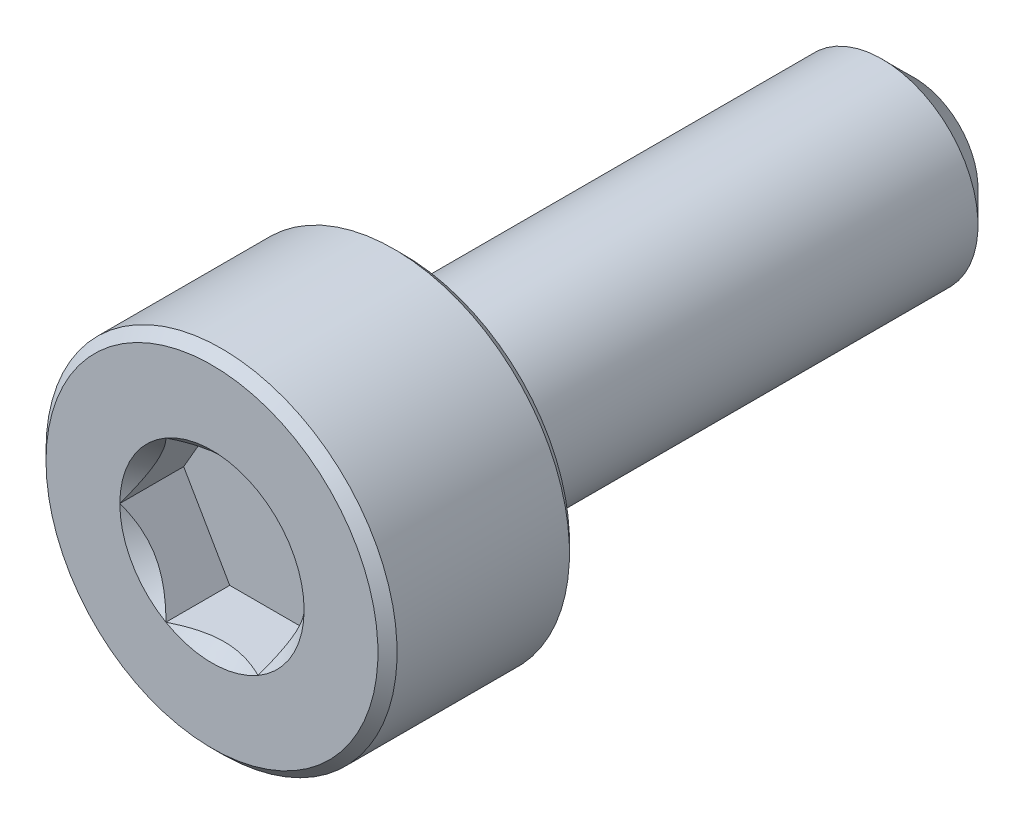
from build123d import *

# Parameters (mm, degrees)
CUT_EXTRUDE1_DEPTH = 1
SKETCH4_R          = 1.443375673
CUT_EXTRUDE2_DEPTH = 0.5
CUT_EXTRUDE2_DRAFT = -45


with BuildPart() as part:
    # Sketch2 → Revolve1 (revolve)
    with BuildSketch(Plane(origin=(0, 0, 0), x_dir=(0, 0, -1), z_dir=(1, 0, 0)), mode=Mode.PRIVATE) as revolve1_sk:
        Polygon((-5.35, 2.75), (-2.65, 2.75), (-2.5, 2.6), (-2.5, 1.5), (5, 1.5), (5.5, 1), (5.5, 0), (-5.5, 0), (-5.5, 2.6), align=None)
    revolve(revolve1_sk.sketch.rotate(Axis((0, 0, -5.5), (0, 0, 1)), 90), axis=Axis((0, 0, -5.5), (0, 0, 1)))

    # Sketch3 → Cut-Extrude1 (cut)
    with BuildSketch(Plane.XY.offset(5.5)):
        Polygon((0.721687836, 1.25), (-0.721687836, 1.25), (-1.443375673, 0), (-0.721687836, -1.25), (0.721687836, -1.25), (1.443375673, 0), align=None)
    extrude(amount=-CUT_EXTRUDE1_DEPTH, mode=Mode.SUBTRACT)


with BuildPart() as cut_extrude2_tool:
    # Sketch4 → Cut-Extrude2 (with draft: the straight prism first)
    with BuildSketch(Plane.XY.offset(5.5)):
        Circle(SKETCH4_R)
    extrude(amount=-CUT_EXTRUDE2_DEPTH)
    # Cut-Extrude2: the draft: its side faces are tilted about the plane it starts from
    cut_extrude2_sides = [cut_extrude2_tool.faces().sort_by_distance(p)[0] for p in [
        (-1.443375673, 0, 5.25),
    ]]
    draft(cut_extrude2_sides, Plane.XY.offset(5.5), CUT_EXTRUDE2_DRAFT)


with BuildPart() as part_1:
    add(part.part)

    # Cut-Extrude2: cut by cut_extrude2_tool
    add(cut_extrude2_tool.part, mode=Mode.SUBTRACT)


solid = part_1.part
